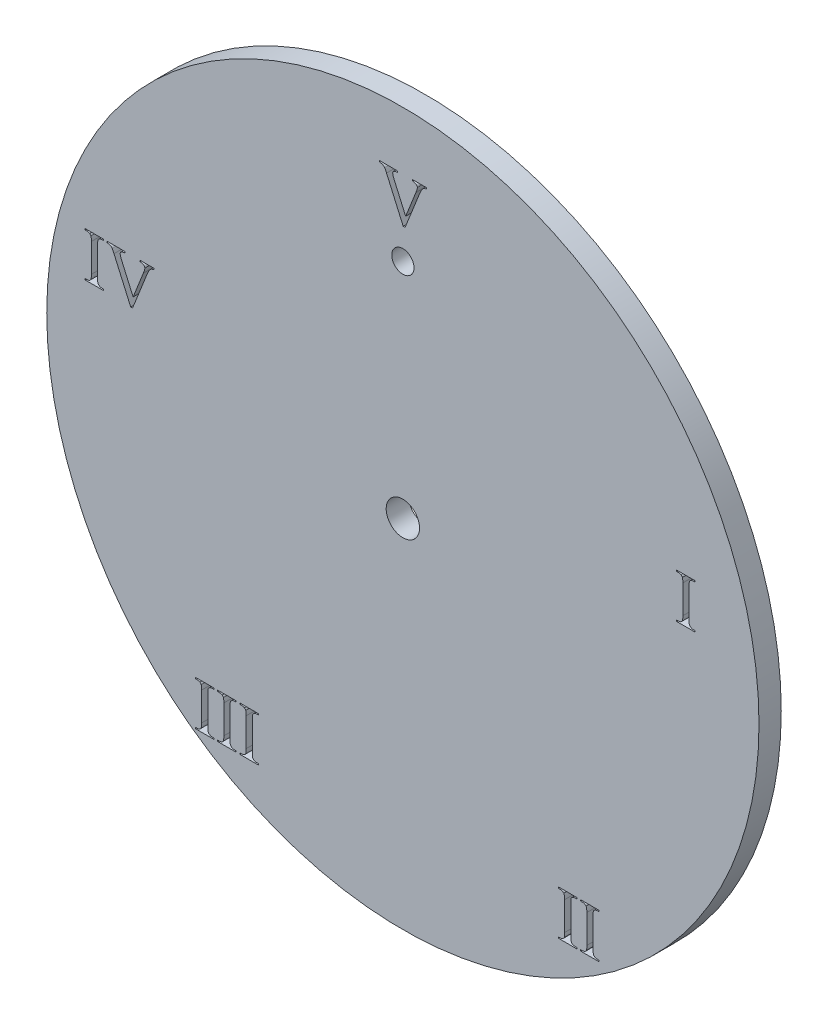
from build123d import *

# Parameters (mm, degrees)
SKETCH2_R           = 101.6
SKETCH2_R_2         = 4.7625
SKETCH2_R_3         = 3.175
BOSS_EXTRUDE1_DEPTH = 6.35


with BuildPart() as part:
    # Sketch2 → Boss-Extrude1 (new body)
    with BuildSketch(Plane.XY):
        Circle(SKETCH2_R)
        Circle(SKETCH2_R_2, mode=Mode.SUBTRACT)
        with Locations((0, 63.5)):
            Circle(SKETCH2_R_3, mode=Mode.SUBTRACT)
        with BuildLine():
            Line((6.735850694, 85.09), (6.735850694, 84.737222222))
            add(Edge.make_bspline(
                [(6.735850694, 84.737222222), (6.630308201, 84.714219785), (6.429742579, 84.670507552), (6.15528874, 84.565762078), (5.914127069, 84.446329477), (5.784111194, 84.335664536), (5.721614583, 84.282469618)],
                knots=[0, 0, 0, 0, 1.150087553, 2.185546491, 3.127820389, 4, 4, 4, 4], degree=3))
            add(Edge.make_bspline(
                [(5.721614583, 84.282469618), (5.63928387, 84.192539883), (5.46564793, 84.002877563), (5.24030193, 83.659739318), (5.033358936, 83.252956281), (4.911857798, 82.955949906), (4.847938368, 82.799700521)],
                knots=[0, 0, 0, 0, 0.843279275, 1.778480768, 2.831301136, 4, 4, 4, 4], degree=3))
            Line((4.847938368, 82.799700521), (0.631141493, 72.213611111))
            Line((0.631141493, 72.213611111), (0.09921875, 72.213611111))
            Line((0.09921875, 72.213611111), (-4.66328125, 82.998138021))
            add(Edge.make_bspline(
                [(-4.66328125, 82.998138021), (-4.692708612, 83.067024462), (-4.748483314, 83.197587327), (-4.827227084, 83.383201532), (-4.903623817, 83.545402081), (-4.966948521, 83.690083458), (-5.031966408, 83.809219685), (-5.084051377, 83.910430127), (-5.129202642, 83.990794294), (-5.161768299, 84.034663169), (-5.175911458, 84.053715278)],
                knots=[0, 0, 0, 0, 1.529564973, 2.899037637, 4.116150385, 5.19045313, 6.121771619, 6.885345418, 7.515909146, 8, 8, 8, 8], degree=3))
            add(Edge.make_bspline(
                [(-5.175911458, 84.053715278), (-5.214889026, 84.102859718), (-5.292358112, 84.200535766), (-5.433902873, 84.322357217), (-5.581928241, 84.436296191), (-5.751454482, 84.526437329), (-5.938715299, 84.606194898), (-6.154848661, 84.665157455), (-6.398945275, 84.71228682), (-6.573031269, 84.72865231), (-6.664192708, 84.737222222)],
                knots=[0, 0, 0, 0, 0.887556751, 1.764045677, 2.639662523, 3.531893419, 4.478056563, 5.521497236, 6.702113387, 8, 8, 8, 8], degree=3))
            Line((-6.664192708, 84.737222222), (-6.664192708, 85.09))
            Line((-6.664192708, 85.09), (-1.502061632, 85.09))
            Line((-1.502061632, 85.09), (-1.502061632, 84.737222222))
            add(Edge.make_bspline(
                [(-1.502061632, 84.737222222), (-1.635725613, 84.723440372), (-1.877942731, 84.698465804), (-2.200875254, 84.627682861), (-2.452571802, 84.553222494), (-2.632995365, 84.449435446), (-2.756795953, 84.330537569), (-2.837608189, 84.196694972), (-2.891077602, 84.049375524), (-2.896567776, 83.944871837), (-2.899392361, 83.891106771)],
                knots=[0, 0, 0, 0, 1.777170112, 3.220471342, 4.374353576, 5.235867464, 5.949763295, 6.621486191, 7.290782096, 8, 8, 8, 8], degree=3))
            add(Edge.make_bspline(
                [(-2.899392361, 83.891106771), (-2.898594946, 83.849668412), (-2.896883644, 83.760739181), (-2.871113855, 83.620376218), (-2.839206751, 83.462741886), (-2.791214446, 83.289102489), (-2.73047816, 83.098819116), (-2.655423231, 82.893488308), (-2.570106603, 82.670290783), (-2.504065955, 82.518322959), (-2.469444444, 82.438654514)],
                knots=[0, 0, 0, 0, 0.652058758, 1.399357611, 2.242571281, 3.187172578, 4.235551921, 5.389454952, 6.631433566, 8, 8, 8, 8], degree=3))
            Line((-2.469444444, 82.438654514), (0.79375, 75.044101562))
            Line((0.79375, 75.044101562), (3.704166667, 82.344947917))
            add(Edge.make_bspline(
                [(3.704166667, 82.344947917), (3.738292377, 82.431251592), (3.803850953, 82.597048759), (3.895488828, 82.835015838), (3.970652483, 83.053917521), (4.029707443, 83.252199134), (4.082768573, 83.42835213), (4.113263232, 83.585621628), (4.139745995, 83.721197594), (4.141553827, 83.80556609), (4.142382812, 83.844253472)],
                knots=[0, 0, 0, 0, 1.419640579, 2.727257979, 3.900501837, 4.958504646, 5.892797517, 6.711382607, 7.409101305, 8, 8, 8, 8], degree=3))
            add(Edge.make_bspline(
                [(4.142382812, 83.844253472), (4.138957219, 83.888738955), (4.131901342, 83.980368071), (4.07957502, 84.115316563), (3.989922366, 84.242978459), (3.870689159, 84.368804208), (3.708677184, 84.484747267), (3.498998494, 84.577383205), (3.246049068, 84.65842494), (3.059805645, 84.691787515), (2.960026042, 84.709661458)],
                knots=[0, 0, 0, 0, 0.671790012, 1.383721652, 2.154073914, 3.018455332, 3.993555146, 5.14295437, 6.469342564, 8, 8, 8, 8], degree=3))
            add(Edge.make_bspline(
                [(2.960026042, 84.709661458), (2.93889427, 84.713325654), (2.886510646, 84.722408841), (2.834161169, 84.731686944), (2.802929687, 84.737222222)],
                knots=[0, 0, 0, 0, 0.806808289, 2, 2, 2, 2], degree=3))
            Line((2.802929687, 84.737222222), (2.802929687, 85.09))
            Line((2.802929687, 85.09), (6.735850694, 85.09))
        make_face(mode=Mode.SUBTRACT)
        with BuildLine():
            Line((83.394843416, 13.947033829), (83.394843416, 13.594256051))
            Line((83.394843416, 13.594256051), (78.103176749, 13.594256051))
            Line((78.103176749, 13.594256051), (78.103176749, 13.947033829))
            Line((78.103176749, 13.947033829), (78.538636819, 13.947033829))
            add(Edge.make_bspline(
                [(78.538636819, 13.947033829), (78.657895293, 13.952117101), (78.882679759, 13.961698313), (79.193837451, 14.05226585), (79.460178768, 14.196595057), (79.586873601, 14.343259544), (79.649335603, 14.415566815)],
                knots=[0, 0, 0, 0, 1.142072474, 2.152636554, 3.089228675, 4, 4, 4, 4], degree=3))
            add(Edge.make_bspline(
                [(79.649335603, 14.415566815), (79.667810772, 14.445368847), (79.708092144, 14.510346157), (79.750441501, 14.629354862), (79.785061335, 14.773649762), (79.814657195, 14.944979788), (79.839595447, 15.142627171), (79.854536688, 15.367158934), (79.866577292, 15.618004899), (79.866897348, 15.794505338), (79.867065638, 15.887311607)],
                knots=[0, 0, 0, 0, 0.558477324, 1.217647012, 2.003767936, 2.927281204, 3.991475019, 5.182702724, 6.518627757, 8, 8, 8, 8], degree=3))
            Line((79.867065638, 15.887311607), (79.867065638, 24.001200496))
            add(Edge.make_bspline(
                [(79.867065638, 24.001200496), (79.866401004, 24.079294437), (79.865126311, 24.229069647), (79.859270504, 24.444048984), (79.852406135, 24.63899194), (79.838096955, 24.812625305), (79.821849403, 24.964303472), (79.803554564, 25.095237551), (79.779203877, 25.205771092), (79.758165276, 25.271872081), (79.748554353, 25.302068551)],
                knots=[0, 0, 0, 0, 1.429813016, 2.742217149, 3.937514499, 5.000517028, 5.931114638, 6.730382289, 7.42000908, 8, 8, 8, 8], degree=3))
            add(Edge.make_bspline(
                [(79.748554353, 25.302068551), (79.7308005, 25.341556578), (79.694973596, 25.421242586), (79.610174422, 25.527822405), (79.505230496, 25.628341873), (79.420704229, 25.683741461), (79.376484041, 25.712723933)],
                knots=[0, 0, 0, 0, 0.918337523, 1.853185807, 2.876887247, 4, 4, 4, 4], degree=3))
            add(Edge.make_bspline(
                [(79.376484041, 25.712723933), (79.310231388, 25.747638829), (79.179366455, 25.816604152), (78.970335576, 25.887198779), (78.756654661, 25.934443923), (78.611466854, 25.939128411), (78.538636819, 25.941478274)],
                knots=[0, 0, 0, 0, 1.021974771, 2.018646118, 3.0061006, 4, 4, 4, 4], degree=3))
            Line((78.538636819, 25.941478274), (78.103176749, 25.941478274))
            Line((78.103176749, 25.941478274), (78.103176749, 26.294256051))
            Line((78.103176749, 26.294256051), (83.394843416, 26.294256051))
            Line((83.394843416, 26.294256051), (83.394843416, 25.941478274))
            Line((83.394843416, 25.941478274), (82.951115117, 25.941478274))
            add(Edge.make_bspline(
                [(82.951115117, 25.941478274), (82.833854063, 25.935962197), (82.613235315, 25.925584073), (82.305033354, 25.84059763), (82.046199481, 25.689575351), (81.919688702, 25.544758878), (81.856952791, 25.472945287)],
                knots=[0, 0, 0, 0, 1.13807004, 2.141201847, 3.078233522, 4, 4, 4, 4], degree=3))
            add(Edge.make_bspline(
                [(81.856952791, 25.472945287), (81.838641439, 25.443072552), (81.798541409, 25.377654248), (81.752818311, 25.259474028), (81.715013323, 25.115242446), (81.686186969, 24.943495924), (81.661965798, 24.745758171), (81.642371449, 24.52151297), (81.631772029, 24.270481713), (81.631236248, 24.093997981), (81.630954527, 24.001200496)],
                knots=[0, 0, 0, 0, 0.557764716, 1.221448966, 2.010247393, 2.932582272, 3.995418194, 5.186297549, 6.520517964, 8, 8, 8, 8], degree=3))
            Line((81.630954527, 24.001200496), (81.630954527, 15.887311607))
            add(Edge.make_bspline(
                [(81.630954527, 15.887311607), (81.631614622, 15.809217273), (81.632880607, 15.65944131), (81.638795846, 15.444467114), (81.645433506, 15.250422707), (81.660289977, 15.076840901), (81.675949159, 14.92510372), (81.694485665, 14.793276635), (81.718812449, 14.682740612), (81.739853685, 14.616639897), (81.749465812, 14.586443551)],
                knots=[0, 0, 0, 0, 1.429820858, 2.742232189, 3.937536094, 4.983777767, 5.931103291, 6.730375326, 7.420005899, 8, 8, 8, 8], degree=3))
            add(Edge.make_bspline(
                [(81.749465812, 14.586443551), (81.767071868, 14.546845746), (81.802830432, 14.466421115), (81.89097438, 14.360747188), (81.998401536, 14.260124884), (82.084666962, 14.204758167), (82.129804353, 14.175788169)],
                knots=[0, 0, 0, 0, 0.908719256, 1.845642983, 2.872757476, 4, 4, 4, 4], degree=3))
            add(Edge.make_bspline(
                [(82.129804353, 14.175788169), (82.19516063, 14.14096913), (82.323432211, 14.072631496), (82.528369793, 14.000797531), (82.737711109, 13.954356709), (82.880134922, 13.949469488), (82.951115117, 13.947033829)],
                knots=[0, 0, 0, 0, 1.029331028, 2.020217884, 3.01332988, 4, 4, 4, 4], degree=3))
            Line((82.951115117, 13.947033829), (83.394843416, 13.947033829))
        make_face(mode=Mode.SUBTRACT)
        with BuildLine():
            Line((50.720202673, -81.186478274), (50.720202673, -81.539256051))
            Line((50.720202673, -81.539256051), (56.01186934, -81.539256051))
            Line((56.01186934, -81.539256051), (56.01186934, -81.186478274))
            Line((56.01186934, -81.186478274), (55.57640927, -81.186478274))
            add(Edge.make_bspline(
                [(55.57640927, -81.186478274), (55.457150796, -81.181395001), (55.23236633, -81.17181379), (54.921208638, -81.081246252), (54.654867321, -80.936917045), (54.528172488, -80.790252558), (54.465710486, -80.717945287)],
                knots=[0, 0, 0, 0, 1.142072474, 2.152636554, 3.089228675, 4, 4, 4, 4], degree=3))
            add(Edge.make_bspline(
                [(54.465710486, -80.717945287), (54.447235317, -80.688143256), (54.406953945, -80.623165945), (54.364604588, -80.504157241), (54.329984754, -80.359862341), (54.300388894, -80.188532315), (54.275450642, -79.990884932), (54.260509401, -79.766353169), (54.248468797, -79.515507203), (54.248148741, -79.339006765), (54.247980451, -79.246200496)],
                knots=[0, 0, 0, 0, 0.558477324, 1.217647012, 2.003767936, 2.927281204, 3.991475019, 5.182702724, 6.518627757, 8, 8, 8, 8], degree=3))
            Line((54.247980451, -79.246200496), (54.247980451, -71.132311607))
            add(Edge.make_bspline(
                [(54.247980451, -71.132311607), (54.248645085, -71.054217666), (54.249919778, -70.904442456), (54.255775585, -70.689463119), (54.262639955, -70.494520163), (54.276949134, -70.320886798), (54.293196686, -70.169208631), (54.311491525, -70.038274551), (54.335842212, -69.92774101), (54.356880813, -69.861640022), (54.366491736, -69.831443551)],
                knots=[0, 0, 0, 0, 1.429813016, 2.742217149, 3.937514499, 5.000517028, 5.931114638, 6.730382289, 7.42000908, 8, 8, 8, 8], degree=3))
            add(Edge.make_bspline(
                [(54.366491736, -69.831443551), (54.384245589, -69.791955524), (54.420072493, -69.712269516), (54.504871667, -69.605689697), (54.609815593, -69.505170229), (54.69434186, -69.449770642), (54.738562048, -69.420788169)],
                knots=[0, 0, 0, 0, 0.918337523, 1.853185807, 2.876887247, 4, 4, 4, 4], degree=3))
            add(Edge.make_bspline(
                [(54.738562048, -69.420788169), (54.804814701, -69.385873273), (54.935679634, -69.316907951), (55.144710513, -69.246313324), (55.358391428, -69.19906818), (55.503579235, -69.194383692), (55.57640927, -69.192033829)],
                knots=[0, 0, 0, 0, 1.021974771, 2.018646118, 3.0061006, 4, 4, 4, 4], degree=3))
            Line((55.57640927, -69.192033829), (56.01186934, -69.192033829))
            Line((56.01186934, -69.192033829), (56.01186934, -68.839256051))
            Line((56.01186934, -68.839256051), (50.720202673, -68.839256051))
            Line((50.720202673, -68.839256051), (50.720202673, -69.192033829))
            Line((50.720202673, -69.192033829), (51.163930972, -69.192033829))
            add(Edge.make_bspline(
                [(51.163930972, -69.192033829), (51.281192026, -69.197549905), (51.501810774, -69.20792803), (51.810012736, -69.292914473), (52.068846608, -69.443936751), (52.195357387, -69.588753224), (52.258093298, -69.660566815)],
                knots=[0, 0, 0, 0, 1.13807004, 2.141201847, 3.078233522, 4, 4, 4, 4], degree=3))
            add(Edge.make_bspline(
                [(52.258093298, -69.660566815), (52.27640465, -69.690439551), (52.316504681, -69.755857855), (52.362227779, -69.874038074), (52.400032766, -70.018269657), (52.42885912, -70.190016179), (52.453080291, -70.387753931), (52.47267464, -70.611999133), (52.48327406, -70.863030389), (52.483809841, -71.039514122), (52.484091562, -71.132311607)],
                knots=[0, 0, 0, 0, 0.557764716, 1.221448966, 2.010247393, 2.932582272, 3.995418194, 5.186297549, 6.520517964, 8, 8, 8, 8], degree=3))
            Line((52.484091562, -71.132311607), (52.484091562, -79.246200496))
            add(Edge.make_bspline(
                [(52.484091562, -79.246200496), (52.483431467, -79.32429483), (52.482165482, -79.474070793), (52.476250243, -79.689044988), (52.469612583, -79.883089396), (52.454756112, -80.056671202), (52.43909693, -80.208408383), (52.420560424, -80.340235468), (52.39623364, -80.450771491), (52.375192404, -80.516872206), (52.365580277, -80.547068551)],
                knots=[0, 0, 0, 0, 1.429820858, 2.742232189, 3.937536094, 4.983777767, 5.931103291, 6.730375326, 7.420005899, 8, 8, 8, 8], degree=3))
            add(Edge.make_bspline(
                [(52.365580277, -80.547068551), (52.347974221, -80.586666356), (52.312215657, -80.667090987), (52.224071709, -80.772764915), (52.116644554, -80.873387219), (52.030379127, -80.928753936), (51.985241736, -80.957723933)],
                knots=[0, 0, 0, 0, 0.908719256, 1.845642983, 2.872757476, 4, 4, 4, 4], degree=3))
            add(Edge.make_bspline(
                [(51.985241736, -80.957723933), (51.919885459, -80.992542973), (51.791613878, -81.060880607), (51.586676296, -81.132714572), (51.37733498, -81.179155393), (51.234911167, -81.184042614), (51.163930972, -81.186478274)],
                knots=[0, 0, 0, 0, 1.029331028, 2.020217884, 3.01332988, 4, 4, 4, 4], degree=3))
            Line((51.163930972, -81.186478274), (50.720202673, -81.186478274))
        make_face(mode=Mode.SUBTRACT)
        with BuildLine():
            Line((44.370202673, -81.186478274), (44.370202673, -81.539256051))
            Line((44.370202673, -81.539256051), (49.66186934, -81.539256051))
            Line((49.66186934, -81.539256051), (49.66186934, -81.186478274))
            Line((49.66186934, -81.186478274), (49.22640927, -81.186478274))
            add(Edge.make_bspline(
                [(49.22640927, -81.186478274), (49.107150796, -81.181395001), (48.88236633, -81.17181379), (48.571208638, -81.081246252), (48.304867321, -80.936917045), (48.178172488, -80.790252558), (48.115710486, -80.717945287)],
                knots=[0, 0, 0, 0, 1.142072474, 2.152636554, 3.089228675, 4, 4, 4, 4], degree=3))
            add(Edge.make_bspline(
                [(48.115710486, -80.717945287), (48.097235317, -80.688143256), (48.056953945, -80.623165945), (48.014604588, -80.504157241), (47.979984754, -80.359862341), (47.950388894, -80.188532315), (47.925450642, -79.990884932), (47.910509401, -79.766353169), (47.898468797, -79.515507203), (47.898148741, -79.339006765), (47.897980451, -79.246200496)],
                knots=[0, 0, 0, 0, 0.558477324, 1.217647012, 2.003767936, 2.927281204, 3.991475019, 5.182702724, 6.518627757, 8, 8, 8, 8], degree=3))
            Line((47.897980451, -79.246200496), (47.897980451, -71.132311607))
            add(Edge.make_bspline(
                [(47.897980451, -71.132311607), (47.898645085, -71.054217666), (47.899919778, -70.904442456), (47.905775585, -70.689463119), (47.912639955, -70.494520163), (47.926949134, -70.320886798), (47.943196686, -70.169208631), (47.961491525, -70.038274551), (47.985842212, -69.92774101), (48.006880813, -69.861640022), (48.016491736, -69.831443551)],
                knots=[0, 0, 0, 0, 1.429813016, 2.742217149, 3.937514499, 5.000517028, 5.931114638, 6.730382289, 7.42000908, 8, 8, 8, 8], degree=3))
            add(Edge.make_bspline(
                [(48.016491736, -69.831443551), (48.034245589, -69.791955524), (48.070072493, -69.712269516), (48.154871667, -69.605689697), (48.259815593, -69.505170229), (48.34434186, -69.449770642), (48.388562048, -69.420788169)],
                knots=[0, 0, 0, 0, 0.918337523, 1.853185807, 2.876887247, 4, 4, 4, 4], degree=3))
            add(Edge.make_bspline(
                [(48.388562048, -69.420788169), (48.454814701, -69.385873273), (48.585679634, -69.316907951), (48.794710513, -69.246313324), (49.008391428, -69.19906818), (49.153579235, -69.194383692), (49.22640927, -69.192033829)],
                knots=[0, 0, 0, 0, 1.021974771, 2.018646118, 3.0061006, 4, 4, 4, 4], degree=3))
            Line((49.22640927, -69.192033829), (49.66186934, -69.192033829))
            Line((49.66186934, -69.192033829), (49.66186934, -68.839256051))
            Line((49.66186934, -68.839256051), (44.370202673, -68.839256051))
            Line((44.370202673, -68.839256051), (44.370202673, -69.192033829))
            Line((44.370202673, -69.192033829), (44.813930972, -69.192033829))
            add(Edge.make_bspline(
                [(44.813930972, -69.192033829), (44.931192026, -69.197549905), (45.151810774, -69.20792803), (45.460012736, -69.292914473), (45.718846608, -69.443936751), (45.845357387, -69.588753224), (45.908093298, -69.660566815)],
                knots=[0, 0, 0, 0, 1.13807004, 2.141201847, 3.078233522, 4, 4, 4, 4], degree=3))
            add(Edge.make_bspline(
                [(45.908093298, -69.660566815), (45.92640465, -69.690439551), (45.966504681, -69.755857855), (46.012227779, -69.874038074), (46.050032766, -70.018269657), (46.07885912, -70.190016179), (46.103080291, -70.387753931), (46.12267464, -70.611999133), (46.13327406, -70.863030389), (46.133809841, -71.039514122), (46.134091562, -71.132311607)],
                knots=[0, 0, 0, 0, 0.557764716, 1.221448966, 2.010247393, 2.932582272, 3.995418194, 5.186297549, 6.520517964, 8, 8, 8, 8], degree=3))
            Line((46.134091562, -71.132311607), (46.134091562, -79.246200496))
            add(Edge.make_bspline(
                [(46.134091562, -79.246200496), (46.133431467, -79.32429483), (46.132165482, -79.474070793), (46.126250243, -79.689044988), (46.119612583, -79.883089396), (46.104756112, -80.056671202), (46.08909693, -80.208408383), (46.070560424, -80.340235468), (46.04623364, -80.450771491), (46.025192404, -80.516872206), (46.015580277, -80.547068551)],
                knots=[0, 0, 0, 0, 1.429820858, 2.742232189, 3.937536094, 4.983777767, 5.931103291, 6.730375326, 7.420005899, 8, 8, 8, 8], degree=3))
            add(Edge.make_bspline(
                [(46.015580277, -80.547068551), (45.997974221, -80.586666356), (45.962215657, -80.667090987), (45.874071709, -80.772764915), (45.766644554, -80.873387219), (45.680379127, -80.928753936), (45.635241736, -80.957723933)],
                knots=[0, 0, 0, 0, 0.908719256, 1.845642983, 2.872757476, 4, 4, 4, 4], degree=3))
            add(Edge.make_bspline(
                [(45.635241736, -80.957723933), (45.569885459, -80.992542973), (45.441613878, -81.060880607), (45.236676296, -81.132714572), (45.02733498, -81.179155393), (44.884911167, -81.184042614), (44.813930972, -81.186478274)],
                knots=[0, 0, 0, 0, 1.029331028, 2.020217884, 3.01332988, 4, 4, 4, 4], degree=3))
            Line((44.813930972, -81.186478274), (44.370202673, -81.186478274))
        make_face(mode=Mode.SUBTRACT)
        with BuildLine():
            Line((-41.195202673, -81.186478274), (-41.195202673, -81.539256051))
            Line((-41.195202673, -81.539256051), (-46.48686934, -81.539256051))
            Line((-46.48686934, -81.539256051), (-46.48686934, -81.186478274))
            Line((-46.48686934, -81.186478274), (-46.05140927, -81.186478274))
            add(Edge.make_bspline(
                [(-46.05140927, -81.186478274), (-45.932150796, -81.181395001), (-45.70736633, -81.17181379), (-45.396208638, -81.081246252), (-45.129867321, -80.936917045), (-45.003172488, -80.790252558), (-44.940710486, -80.717945287)],
                knots=[0, 0, 0, 0, 1.142072474, 2.152636554, 3.089228675, 4, 4, 4, 4], degree=3))
            add(Edge.make_bspline(
                [(-44.940710486, -80.717945287), (-44.922235317, -80.688143256), (-44.881953945, -80.623165945), (-44.839604588, -80.504157241), (-44.804984754, -80.359862341), (-44.775388894, -80.188532315), (-44.750450642, -79.990884932), (-44.735509401, -79.766353169), (-44.723468797, -79.515507203), (-44.723148741, -79.339006765), (-44.722980451, -79.246200496)],
                knots=[0, 0, 0, 0, 0.558477324, 1.217647012, 2.003767936, 2.927281204, 3.991475019, 5.182702724, 6.518627757, 8, 8, 8, 8], degree=3))
            Line((-44.722980451, -79.246200496), (-44.722980451, -71.132311607))
            add(Edge.make_bspline(
                [(-44.722980451, -71.132311607), (-44.723645085, -71.054217666), (-44.724919778, -70.904442456), (-44.730775585, -70.689463119), (-44.737639955, -70.494520163), (-44.751949134, -70.320886798), (-44.768196686, -70.169208631), (-44.786491525, -70.038274551), (-44.810842212, -69.92774101), (-44.831880813, -69.861640022), (-44.841491736, -69.831443551)],
                knots=[0, 0, 0, 0, 1.429813016, 2.742217149, 3.937514499, 5.000517028, 5.931114638, 6.730382289, 7.42000908, 8, 8, 8, 8], degree=3))
            add(Edge.make_bspline(
                [(-44.841491736, -69.831443551), (-44.859245589, -69.791955524), (-44.895072493, -69.712269516), (-44.979871667, -69.605689697), (-45.084815593, -69.505170229), (-45.16934186, -69.449770642), (-45.213562048, -69.420788169)],
                knots=[0, 0, 0, 0, 0.918337523, 1.853185807, 2.876887247, 4, 4, 4, 4], degree=3))
            add(Edge.make_bspline(
                [(-45.213562048, -69.420788169), (-45.279814701, -69.385873273), (-45.410679634, -69.316907951), (-45.619710513, -69.246313324), (-45.833391428, -69.19906818), (-45.978579235, -69.194383692), (-46.05140927, -69.192033829)],
                knots=[0, 0, 0, 0, 1.021974771, 2.018646118, 3.0061006, 4, 4, 4, 4], degree=3))
            Line((-46.05140927, -69.192033829), (-46.48686934, -69.192033829))
            Line((-46.48686934, -69.192033829), (-46.48686934, -68.839256051))
            Line((-46.48686934, -68.839256051), (-41.195202673, -68.839256051))
            Line((-41.195202673, -68.839256051), (-41.195202673, -69.192033829))
            Line((-41.195202673, -69.192033829), (-41.638930972, -69.192033829))
            add(Edge.make_bspline(
                [(-41.638930972, -69.192033829), (-41.756192026, -69.197549905), (-41.976810774, -69.20792803), (-42.285012736, -69.292914473), (-42.543846608, -69.443936751), (-42.670357387, -69.588753224), (-42.733093298, -69.660566815)],
                knots=[0, 0, 0, 0, 1.13807004, 2.141201847, 3.078233522, 4, 4, 4, 4], degree=3))
            add(Edge.make_bspline(
                [(-42.733093298, -69.660566815), (-42.75140465, -69.690439551), (-42.791504681, -69.755857855), (-42.837227779, -69.874038074), (-42.875032766, -70.018269657), (-42.90385912, -70.190016179), (-42.928080291, -70.387753931), (-42.94767464, -70.611999133), (-42.95827406, -70.863030389), (-42.958809841, -71.039514122), (-42.959091562, -71.132311607)],
                knots=[0, 0, 0, 0, 0.557764716, 1.221448966, 2.010247393, 2.932582272, 3.995418194, 5.186297549, 6.520517964, 8, 8, 8, 8], degree=3))
            Line((-42.959091562, -71.132311607), (-42.959091562, -79.246200496))
            add(Edge.make_bspline(
                [(-42.959091562, -79.246200496), (-42.958431467, -79.32429483), (-42.957165482, -79.474070793), (-42.951250243, -79.689044988), (-42.944612583, -79.883089396), (-42.929756112, -80.056671202), (-42.91409693, -80.208408383), (-42.895560424, -80.340235468), (-42.87123364, -80.450771491), (-42.850192404, -80.516872206), (-42.840580277, -80.547068551)],
                knots=[0, 0, 0, 0, 1.429820858, 2.742232189, 3.937536094, 4.983777767, 5.931103291, 6.730375326, 7.420005899, 8, 8, 8, 8], degree=3))
            add(Edge.make_bspline(
                [(-42.840580277, -80.547068551), (-42.822974221, -80.586666356), (-42.787215657, -80.667090987), (-42.699071709, -80.772764915), (-42.591644554, -80.873387219), (-42.505379127, -80.928753936), (-42.460241736, -80.957723933)],
                knots=[0, 0, 0, 0, 0.908719256, 1.845642983, 2.872757476, 4, 4, 4, 4], degree=3))
            add(Edge.make_bspline(
                [(-42.460241736, -80.957723933), (-42.394885459, -80.992542973), (-42.266613878, -81.060880607), (-42.061676296, -81.132714572), (-41.85233498, -81.179155393), (-41.709911167, -81.184042614), (-41.638930972, -81.186478274)],
                knots=[0, 0, 0, 0, 1.029331028, 2.020217884, 3.01332988, 4, 4, 4, 4], degree=3))
            Line((-41.638930972, -81.186478274), (-41.195202673, -81.186478274))
        make_face(mode=Mode.SUBTRACT)
        with BuildLine():
            Line((-47.545202673, -81.186478274), (-47.545202673, -81.539256051))
            Line((-47.545202673, -81.539256051), (-52.83686934, -81.539256051))
            Line((-52.83686934, -81.539256051), (-52.83686934, -81.186478274))
            Line((-52.83686934, -81.186478274), (-52.40140927, -81.186478274))
            add(Edge.make_bspline(
                [(-52.40140927, -81.186478274), (-52.282150796, -81.181395001), (-52.05736633, -81.17181379), (-51.746208638, -81.081246252), (-51.479867321, -80.936917045), (-51.353172488, -80.790252558), (-51.290710486, -80.717945287)],
                knots=[0, 0, 0, 0, 1.142072474, 2.152636554, 3.089228675, 4, 4, 4, 4], degree=3))
            add(Edge.make_bspline(
                [(-51.290710486, -80.717945287), (-51.272235317, -80.688143256), (-51.231953945, -80.623165945), (-51.189604588, -80.504157241), (-51.154984754, -80.359862341), (-51.125388894, -80.188532315), (-51.100450642, -79.990884932), (-51.085509401, -79.766353169), (-51.073468797, -79.515507203), (-51.073148741, -79.339006765), (-51.072980451, -79.246200496)],
                knots=[0, 0, 0, 0, 0.558477324, 1.217647012, 2.003767936, 2.927281204, 3.991475019, 5.182702724, 6.518627757, 8, 8, 8, 8], degree=3))
            Line((-51.072980451, -79.246200496), (-51.072980451, -71.132311607))
            add(Edge.make_bspline(
                [(-51.072980451, -71.132311607), (-51.073645085, -71.054217666), (-51.074919778, -70.904442456), (-51.080775585, -70.689463119), (-51.087639955, -70.494520163), (-51.101949134, -70.320886798), (-51.118196686, -70.169208631), (-51.136491525, -70.038274551), (-51.160842212, -69.92774101), (-51.181880813, -69.861640022), (-51.191491736, -69.831443551)],
                knots=[0, 0, 0, 0, 1.429813016, 2.742217149, 3.937514499, 5.000517028, 5.931114638, 6.730382289, 7.42000908, 8, 8, 8, 8], degree=3))
            add(Edge.make_bspline(
                [(-51.191491736, -69.831443551), (-51.209245589, -69.791955524), (-51.245072493, -69.712269516), (-51.329871667, -69.605689697), (-51.434815593, -69.505170229), (-51.51934186, -69.449770642), (-51.563562048, -69.420788169)],
                knots=[0, 0, 0, 0, 0.918337523, 1.853185807, 2.876887247, 4, 4, 4, 4], degree=3))
            add(Edge.make_bspline(
                [(-51.563562048, -69.420788169), (-51.629814701, -69.385873273), (-51.760679634, -69.316907951), (-51.969710513, -69.246313324), (-52.183391428, -69.19906818), (-52.328579235, -69.194383692), (-52.40140927, -69.192033829)],
                knots=[0, 0, 0, 0, 1.021974771, 2.018646118, 3.0061006, 4, 4, 4, 4], degree=3))
            Line((-52.40140927, -69.192033829), (-52.83686934, -69.192033829))
            Line((-52.83686934, -69.192033829), (-52.83686934, -68.839256051))
            Line((-52.83686934, -68.839256051), (-47.545202673, -68.839256051))
            Line((-47.545202673, -68.839256051), (-47.545202673, -69.192033829))
            Line((-47.545202673, -69.192033829), (-47.988930972, -69.192033829))
            add(Edge.make_bspline(
                [(-47.988930972, -69.192033829), (-48.106192026, -69.197549905), (-48.326810774, -69.20792803), (-48.635012736, -69.292914473), (-48.893846608, -69.443936751), (-49.020357387, -69.588753224), (-49.083093298, -69.660566815)],
                knots=[0, 0, 0, 0, 1.13807004, 2.141201847, 3.078233522, 4, 4, 4, 4], degree=3))
            add(Edge.make_bspline(
                [(-49.083093298, -69.660566815), (-49.10140465, -69.690439551), (-49.141504681, -69.755857855), (-49.187227779, -69.874038074), (-49.225032766, -70.018269657), (-49.25385912, -70.190016179), (-49.278080291, -70.387753931), (-49.29767464, -70.611999133), (-49.30827406, -70.863030389), (-49.308809841, -71.039514122), (-49.309091562, -71.132311607)],
                knots=[0, 0, 0, 0, 0.557764716, 1.221448966, 2.010247393, 2.932582272, 3.995418194, 5.186297549, 6.520517964, 8, 8, 8, 8], degree=3))
            Line((-49.309091562, -71.132311607), (-49.309091562, -79.246200496))
            add(Edge.make_bspline(
                [(-49.309091562, -79.246200496), (-49.308431467, -79.32429483), (-49.307165482, -79.474070793), (-49.301250243, -79.689044988), (-49.294612583, -79.883089396), (-49.279756112, -80.056671202), (-49.26409693, -80.208408383), (-49.245560424, -80.340235468), (-49.22123364, -80.450771491), (-49.200192404, -80.516872206), (-49.190580277, -80.547068551)],
                knots=[0, 0, 0, 0, 1.429820858, 2.742232189, 3.937536094, 4.983777767, 5.931103291, 6.730375326, 7.420005899, 8, 8, 8, 8], degree=3))
            add(Edge.make_bspline(
                [(-49.190580277, -80.547068551), (-49.172974221, -80.586666356), (-49.137215657, -80.667090987), (-49.049071709, -80.772764915), (-48.941644554, -80.873387219), (-48.855379127, -80.928753936), (-48.810241736, -80.957723933)],
                knots=[0, 0, 0, 0, 0.908719256, 1.845642983, 2.872757476, 4, 4, 4, 4], degree=3))
            add(Edge.make_bspline(
                [(-48.810241736, -80.957723933), (-48.744885459, -80.992542973), (-48.616613878, -81.060880607), (-48.411676296, -81.132714572), (-48.20233498, -81.179155393), (-48.059911167, -81.184042614), (-47.988930972, -81.186478274)],
                knots=[0, 0, 0, 0, 1.029331028, 2.020217884, 3.01332988, 4, 4, 4, 4], degree=3))
            Line((-47.988930972, -81.186478274), (-47.545202673, -81.186478274))
        make_face(mode=Mode.SUBTRACT)
        with BuildLine():
            Line((-53.895202673, -81.186478274), (-53.895202673, -81.539256051))
            Line((-53.895202673, -81.539256051), (-59.18686934, -81.539256051))
            Line((-59.18686934, -81.539256051), (-59.18686934, -81.186478274))
            Line((-59.18686934, -81.186478274), (-58.75140927, -81.186478274))
            add(Edge.make_bspline(
                [(-58.75140927, -81.186478274), (-58.632150796, -81.181395001), (-58.40736633, -81.17181379), (-58.096208638, -81.081246252), (-57.829867321, -80.936917045), (-57.703172488, -80.790252558), (-57.640710486, -80.717945287)],
                knots=[0, 0, 0, 0, 1.142072474, 2.152636554, 3.089228675, 4, 4, 4, 4], degree=3))
            add(Edge.make_bspline(
                [(-57.640710486, -80.717945287), (-57.622235317, -80.688143256), (-57.581953945, -80.623165945), (-57.539604588, -80.504157241), (-57.504984754, -80.359862341), (-57.475388894, -80.188532315), (-57.450450642, -79.990884932), (-57.435509401, -79.766353169), (-57.423468797, -79.515507203), (-57.423148741, -79.339006765), (-57.422980451, -79.246200496)],
                knots=[0, 0, 0, 0, 0.558477324, 1.217647012, 2.003767936, 2.927281204, 3.991475019, 5.182702724, 6.518627757, 8, 8, 8, 8], degree=3))
            Line((-57.422980451, -79.246200496), (-57.422980451, -71.132311607))
            add(Edge.make_bspline(
                [(-57.422980451, -71.132311607), (-57.423645085, -71.054217666), (-57.424919778, -70.904442456), (-57.430775585, -70.689463119), (-57.437639955, -70.494520163), (-57.451949134, -70.320886798), (-57.468196686, -70.169208631), (-57.486491525, -70.038274551), (-57.510842212, -69.92774101), (-57.531880813, -69.861640022), (-57.541491736, -69.831443551)],
                knots=[0, 0, 0, 0, 1.429813016, 2.742217149, 3.937514499, 5.000517028, 5.931114638, 6.730382289, 7.42000908, 8, 8, 8, 8], degree=3))
            add(Edge.make_bspline(
                [(-57.541491736, -69.831443551), (-57.559245589, -69.791955524), (-57.595072493, -69.712269516), (-57.679871667, -69.605689697), (-57.784815593, -69.505170229), (-57.86934186, -69.449770642), (-57.913562048, -69.420788169)],
                knots=[0, 0, 0, 0, 0.918337523, 1.853185807, 2.876887247, 4, 4, 4, 4], degree=3))
            add(Edge.make_bspline(
                [(-57.913562048, -69.420788169), (-57.979814701, -69.385873273), (-58.110679634, -69.316907951), (-58.319710513, -69.246313324), (-58.533391428, -69.19906818), (-58.678579235, -69.194383692), (-58.75140927, -69.192033829)],
                knots=[0, 0, 0, 0, 1.021974771, 2.018646118, 3.0061006, 4, 4, 4, 4], degree=3))
            Line((-58.75140927, -69.192033829), (-59.18686934, -69.192033829))
            Line((-59.18686934, -69.192033829), (-59.18686934, -68.839256051))
            Line((-59.18686934, -68.839256051), (-53.895202673, -68.839256051))
            Line((-53.895202673, -68.839256051), (-53.895202673, -69.192033829))
            Line((-53.895202673, -69.192033829), (-54.338930972, -69.192033829))
            add(Edge.make_bspline(
                [(-54.338930972, -69.192033829), (-54.456192026, -69.197549905), (-54.676810774, -69.20792803), (-54.985012736, -69.292914473), (-55.243846608, -69.443936751), (-55.370357387, -69.588753224), (-55.433093298, -69.660566815)],
                knots=[0, 0, 0, 0, 1.13807004, 2.141201847, 3.078233522, 4, 4, 4, 4], degree=3))
            add(Edge.make_bspline(
                [(-55.433093298, -69.660566815), (-55.45140465, -69.690439551), (-55.491504681, -69.755857855), (-55.537227779, -69.874038074), (-55.575032766, -70.018269657), (-55.60385912, -70.190016179), (-55.628080291, -70.387753931), (-55.64767464, -70.611999133), (-55.65827406, -70.863030389), (-55.658809841, -71.039514122), (-55.659091562, -71.132311607)],
                knots=[0, 0, 0, 0, 0.557764716, 1.221448966, 2.010247393, 2.932582272, 3.995418194, 5.186297549, 6.520517964, 8, 8, 8, 8], degree=3))
            Line((-55.659091562, -71.132311607), (-55.659091562, -79.246200496))
            add(Edge.make_bspline(
                [(-55.659091562, -79.246200496), (-55.658431467, -79.32429483), (-55.657165482, -79.474070793), (-55.651250243, -79.689044988), (-55.644612583, -79.883089396), (-55.629756112, -80.056671202), (-55.61409693, -80.208408383), (-55.595560424, -80.340235468), (-55.57123364, -80.450771491), (-55.550192404, -80.516872206), (-55.540580277, -80.547068551)],
                knots=[0, 0, 0, 0, 1.429820858, 2.742232189, 3.937536094, 4.983777767, 5.931103291, 6.730375326, 7.420005899, 8, 8, 8, 8], degree=3))
            add(Edge.make_bspline(
                [(-55.540580277, -80.547068551), (-55.522974221, -80.586666356), (-55.487215657, -80.667090987), (-55.399071709, -80.772764915), (-55.291644554, -80.873387219), (-55.205379127, -80.928753936), (-55.160241736, -80.957723933)],
                knots=[0, 0, 0, 0, 0.908719256, 1.845642983, 2.872757476, 4, 4, 4, 4], degree=3))
            add(Edge.make_bspline(
                [(-55.160241736, -80.957723933), (-55.094885459, -80.992542973), (-54.966613878, -81.060880607), (-54.761676296, -81.132714572), (-54.55233498, -81.179155393), (-54.409911167, -81.184042614), (-54.338930972, -81.186478274)],
                knots=[0, 0, 0, 0, 1.029331028, 2.020217884, 3.01332988, 4, 4, 4, 4], degree=3))
            Line((-54.338930972, -81.186478274), (-53.895202673, -81.186478274))
        make_face(mode=Mode.SUBTRACT)
        with BuildLine():
            Line((-71.014548277, 26.294256051), (-71.014548277, 25.941478274))
            add(Edge.make_bspline(
                [(-71.014548277, 25.941478274), (-71.12009077, 25.918475837), (-71.320656392, 25.874763604), (-71.595110231, 25.77001813), (-71.836271903, 25.650585528), (-71.966287777, 25.539920587), (-72.028784388, 25.486725669)],
                knots=[0, 0, 0, 0, 1.150087553, 2.185546491, 3.127820389, 4, 4, 4, 4], degree=3))
            add(Edge.make_bspline(
                [(-72.028784388, 25.486725669), (-72.111115101, 25.396795935), (-72.284751042, 25.207133614), (-72.510097041, 24.86399537), (-72.717040036, 24.457212332), (-72.838541174, 24.160205957), (-72.902460603, 24.003956572)],
                knots=[0, 0, 0, 0, 0.843279275, 1.778480768, 2.831301136, 4, 4, 4, 4], degree=3))
            Line((-72.902460603, 24.003956572), (-77.119257478, 13.417867162))
            Line((-77.119257478, 13.417867162), (-77.651180222, 13.417867162))
            Line((-77.651180222, 13.417867162), (-82.413680222, 24.202394072))
            add(Edge.make_bspline(
                [(-82.413680222, 24.202394072), (-82.443107584, 24.271280513), (-82.498882285, 24.401843378), (-82.577626056, 24.587457583), (-82.654022789, 24.749658133), (-82.717347493, 24.894339509), (-82.782365379, 25.013475736), (-82.834450348, 25.114686179), (-82.879601614, 25.195050345), (-82.912167271, 25.23891922), (-82.92631043, 25.257971329)],
                knots=[0, 0, 0, 0, 1.529564973, 2.899037637, 4.116150385, 5.19045313, 6.121771619, 6.885345418, 7.515909146, 8, 8, 8, 8], degree=3))
            add(Edge.make_bspline(
                [(-82.92631043, 25.257971329), (-82.965287998, 25.307115769), (-83.042757084, 25.404791818), (-83.184301844, 25.526613269), (-83.332327213, 25.640552242), (-83.501853454, 25.730693381), (-83.689114271, 25.810450949), (-83.905247632, 25.869413506), (-84.149344247, 25.916542872), (-84.32343024, 25.932908362), (-84.41459168, 25.941478274)],
                knots=[0, 0, 0, 0, 0.887556751, 1.764045677, 2.639662523, 3.531893419, 4.478056563, 5.521497236, 6.702113387, 8, 8, 8, 8], degree=3))
            Line((-84.41459168, 25.941478274), (-84.41459168, 26.294256051))
            Line((-84.41459168, 26.294256051), (-79.252460603, 26.294256051))
            Line((-79.252460603, 26.294256051), (-79.252460603, 25.941478274))
            add(Edge.make_bspline(
                [(-79.252460603, 25.941478274), (-79.386124585, 25.927696423), (-79.628341702, 25.902721856), (-79.951274226, 25.831938913), (-80.202970774, 25.757478545), (-80.383394337, 25.653691497), (-80.507194925, 25.534793621), (-80.58800716, 25.400951024), (-80.641476574, 25.253631575), (-80.646966748, 25.149127888), (-80.649791333, 25.095362822)],
                knots=[0, 0, 0, 0, 1.777170112, 3.220471342, 4.374353576, 5.235867464, 5.949763295, 6.621486191, 7.290782096, 8, 8, 8, 8], degree=3))
            add(Edge.make_bspline(
                [(-80.649791333, 25.095362822), (-80.648993917, 25.053924463), (-80.647282616, 24.964995233), (-80.621512827, 24.82463227), (-80.589605722, 24.666997938), (-80.541613418, 24.49335854), (-80.480877131, 24.303075167), (-80.405822203, 24.09774436), (-80.320505574, 23.874546835), (-80.254464927, 23.72257901), (-80.219843416, 23.642910565)],
                knots=[0, 0, 0, 0, 0.652058758, 1.399357611, 2.242571281, 3.187172578, 4.235551921, 5.389454952, 6.631433566, 8, 8, 8, 8], degree=3))
            Line((-80.219843416, 23.642910565), (-76.956648972, 16.248357614))
            Line((-76.956648972, 16.248357614), (-74.046232305, 23.549203968))
            add(Edge.make_bspline(
                [(-74.046232305, 23.549203968), (-74.012106595, 23.635507643), (-73.946548019, 23.80130481), (-73.854910143, 24.03927189), (-73.779746489, 24.258173572), (-73.720691529, 24.456455186), (-73.667630399, 24.632608181), (-73.637135739, 24.789877679), (-73.610652976, 24.925453646), (-73.608845145, 25.009822141), (-73.608016159, 25.048509524)],
                knots=[0, 0, 0, 0, 1.419640579, 2.727257979, 3.900501837, 4.958504646, 5.892797517, 6.711382607, 7.409101305, 8, 8, 8, 8], degree=3))
            add(Edge.make_bspline(
                [(-73.608016159, 25.048509524), (-73.611441753, 25.092995006), (-73.61849763, 25.184624122), (-73.670823951, 25.319572614), (-73.760476605, 25.447234511), (-73.879709812, 25.573060259), (-74.041721787, 25.689003318), (-74.251400477, 25.781639256), (-74.504349904, 25.862680991), (-74.690593326, 25.896043566), (-74.79037293, 25.91391751)],
                knots=[0, 0, 0, 0, 0.671790012, 1.383721652, 2.154073914, 3.018455332, 3.993555146, 5.14295437, 6.469342564, 8, 8, 8, 8], degree=3))
            add(Edge.make_bspline(
                [(-74.79037293, 25.91391751), (-74.811504701, 25.917581705), (-74.863888326, 25.926664892), (-74.916237803, 25.935942995), (-74.947469284, 25.941478274)],
                knots=[0, 0, 0, 0, 0.806808289, 2, 2, 2, 2], degree=3))
            Line((-74.947469284, 25.941478274), (-74.947469284, 26.294256051))
            Line((-74.947469284, 26.294256051), (-71.014548277, 26.294256051))
        make_face(mode=Mode.SUBTRACT)
        with BuildLine():
            Line((-85.335121194, 13.947033829), (-85.335121194, 13.594256051))
            Line((-85.335121194, 13.594256051), (-90.62678786, 13.594256051))
            Line((-90.62678786, 13.594256051), (-90.62678786, 13.947033829))
            Line((-90.62678786, 13.947033829), (-90.191327791, 13.947033829))
            add(Edge.make_bspline(
                [(-90.191327791, 13.947033829), (-90.072069317, 13.952117101), (-89.847284851, 13.961698313), (-89.536127159, 14.05226585), (-89.269785841, 14.196595057), (-89.143091009, 14.343259544), (-89.080629006, 14.415566815)],
                knots=[0, 0, 0, 0, 1.142072474, 2.152636554, 3.089228675, 4, 4, 4, 4], degree=3))
            add(Edge.make_bspline(
                [(-89.080629006, 14.415566815), (-89.062153838, 14.445368847), (-89.021872465, 14.510346157), (-88.979523109, 14.629354862), (-88.944903275, 14.773649762), (-88.915307414, 14.944979788), (-88.890369163, 15.142627171), (-88.875427922, 15.367158934), (-88.863387318, 15.618004899), (-88.863067261, 15.794505338), (-88.862898972, 15.887311607)],
                knots=[0, 0, 0, 0, 0.558477324, 1.217647012, 2.003767936, 2.927281204, 3.991475019, 5.182702724, 6.518627757, 8, 8, 8, 8], degree=3))
            Line((-88.862898972, 15.887311607), (-88.862898972, 24.001200496))
            add(Edge.make_bspline(
                [(-88.862898972, 24.001200496), (-88.863563606, 24.079294437), (-88.864838299, 24.229069647), (-88.870694105, 24.444048984), (-88.877558475, 24.63899194), (-88.891867655, 24.812625305), (-88.908115207, 24.964303472), (-88.926410046, 25.095237551), (-88.950760732, 25.205771092), (-88.971799334, 25.271872081), (-88.981410256, 25.302068551)],
                knots=[0, 0, 0, 0, 1.429813016, 2.742217149, 3.937514499, 5.000517028, 5.931114638, 6.730382289, 7.42000908, 8, 8, 8, 8], degree=3))
            add(Edge.make_bspline(
                [(-88.981410256, 25.302068551), (-88.99916411, 25.341556578), (-89.034991013, 25.421242586), (-89.119790187, 25.527822405), (-89.224734114, 25.628341873), (-89.309260381, 25.683741461), (-89.353480569, 25.712723933)],
                knots=[0, 0, 0, 0, 0.918337523, 1.853185807, 2.876887247, 4, 4, 4, 4], degree=3))
            add(Edge.make_bspline(
                [(-89.353480569, 25.712723933), (-89.419733222, 25.747638829), (-89.550598155, 25.816604152), (-89.759629034, 25.887198779), (-89.973309949, 25.934443923), (-90.118497755, 25.939128411), (-90.191327791, 25.941478274)],
                knots=[0, 0, 0, 0, 1.021974771, 2.018646118, 3.0061006, 4, 4, 4, 4], degree=3))
            Line((-90.191327791, 25.941478274), (-90.62678786, 25.941478274))
            Line((-90.62678786, 25.941478274), (-90.62678786, 26.294256051))
            Line((-90.62678786, 26.294256051), (-85.335121194, 26.294256051))
            Line((-85.335121194, 26.294256051), (-85.335121194, 25.941478274))
            Line((-85.335121194, 25.941478274), (-85.778849492, 25.941478274))
            add(Edge.make_bspline(
                [(-85.778849492, 25.941478274), (-85.896110547, 25.935962197), (-86.116729295, 25.925584073), (-86.424931256, 25.84059763), (-86.683765129, 25.689575351), (-86.810275908, 25.544758878), (-86.873011819, 25.472945287)],
                knots=[0, 0, 0, 0, 1.13807004, 2.141201847, 3.078233522, 4, 4, 4, 4], degree=3))
            add(Edge.make_bspline(
                [(-86.873011819, 25.472945287), (-86.891323171, 25.443072552), (-86.931423201, 25.377654248), (-86.977146299, 25.259474028), (-87.014951287, 25.115242446), (-87.043777641, 24.943495924), (-87.067998812, 24.745758171), (-87.087593161, 24.52151297), (-87.098192581, 24.270481713), (-87.098728362, 24.093997981), (-87.099010083, 24.001200496)],
                knots=[0, 0, 0, 0, 0.557764716, 1.221448966, 2.010247393, 2.932582272, 3.995418194, 5.186297549, 6.520517964, 8, 8, 8, 8], degree=3))
            Line((-87.099010083, 24.001200496), (-87.099010083, 15.887311607))
            add(Edge.make_bspline(
                [(-87.099010083, 15.887311607), (-87.098349988, 15.809217273), (-87.097084002, 15.65944131), (-87.091168764, 15.444467114), (-87.084531103, 15.250422707), (-87.069674633, 15.076840901), (-87.054015451, 14.92510372), (-87.035478945, 14.793276635), (-87.01115216, 14.682740612), (-86.990110924, 14.616639897), (-86.980498798, 14.586443551)],
                knots=[0, 0, 0, 0, 1.429820858, 2.742232189, 3.937536094, 4.983777767, 5.931103291, 6.730375326, 7.420005899, 8, 8, 8, 8], degree=3))
            add(Edge.make_bspline(
                [(-86.980498798, 14.586443551), (-86.962892741, 14.546845746), (-86.927134178, 14.466421115), (-86.83899023, 14.360747188), (-86.731563074, 14.260124884), (-86.645297648, 14.204758167), (-86.600160256, 14.175788169)],
                knots=[0, 0, 0, 0, 0.908719256, 1.845642983, 2.872757476, 4, 4, 4, 4], degree=3))
            add(Edge.make_bspline(
                [(-86.600160256, 14.175788169), (-86.53480398, 14.14096913), (-86.406532398, 14.072631496), (-86.201594817, 14.000797531), (-85.992253501, 13.954356709), (-85.849829687, 13.949469488), (-85.778849492, 13.947033829)],
                knots=[0, 0, 0, 0, 1.029331028, 2.020217884, 3.01332988, 4, 4, 4, 4], degree=3))
            Line((-85.778849492, 13.947033829), (-85.335121194, 13.947033829))
        make_face(mode=Mode.SUBTRACT)
    extrude(amount=BOSS_EXTRUDE1_DEPTH)


solid = part.part
